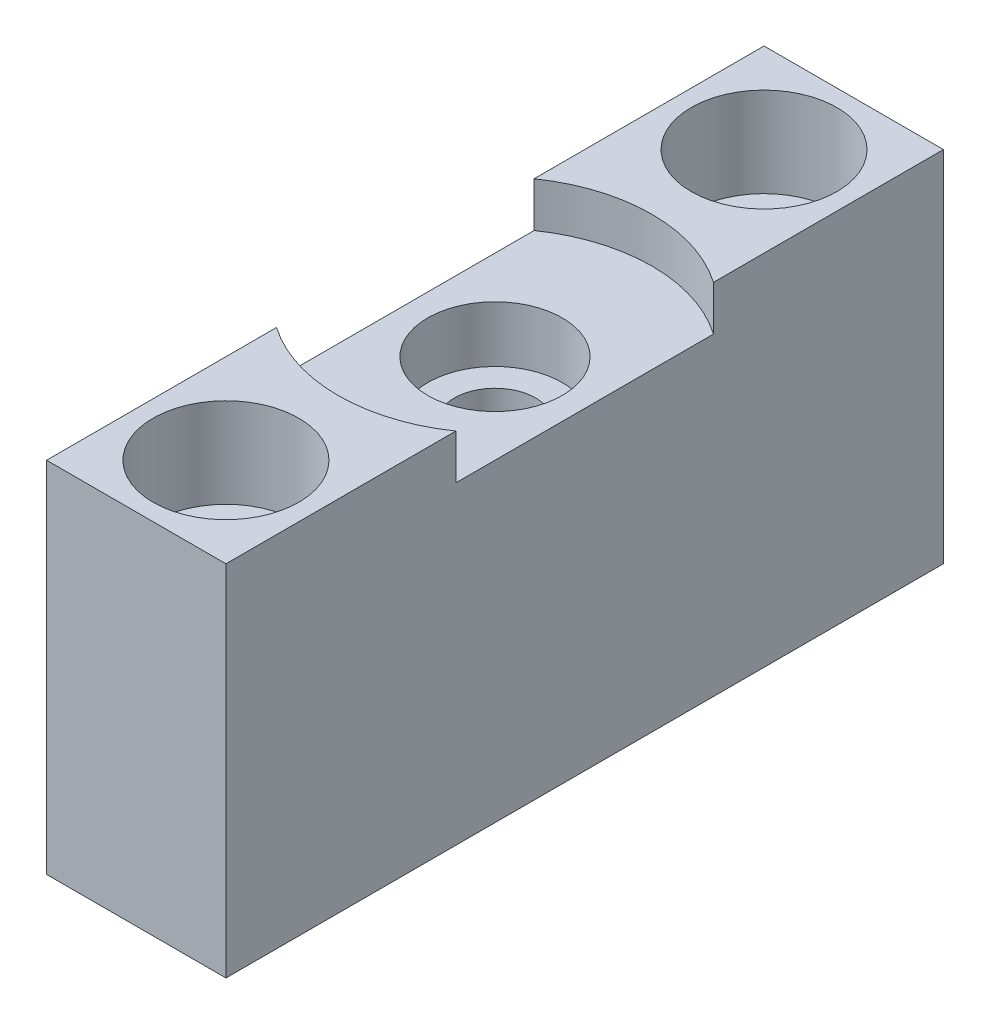
from build123d import *

# Parameters (mm, degrees)
SKETCH1_W                                        = 101.6
SKETCH1_H                                        = 50.8
BOSS_EXTRUDE1_DEPTH                              = 25.4
SKETCH2_R                                        = 22.225
CUT_EXTRUDE1_DEPTH                               = 6.35
SKETCH3_R                                        = 9.525
CUT_EXTRUDE2_DEPTH                               = 7.9375
F_1_2_20_TAPPED_HOLE1_D                          = 11.50874
CBORE_FOR_1_2_SOCKET_HEAD_CAP_SCREW1_D           = 13.49248
CBORE_FOR_1_2_SOCKET_HEAD_CAP_SCREW1_CBORE_D     = 20.6375
CBORE_FOR_1_2_SOCKET_HEAD_CAP_SCREW1_CBORE_DEPTH = 12.7


with BuildPart() as part:
    # Sketch1 → Boss-Extrude1 (new body)
    with BuildSketch(Plane(origin=(0, 0, 0), x_dir=(0, 0, -1), z_dir=(1, 0, 0))):
        with Locations((50.8, 25.4)):
            Rectangle(SKETCH1_W, SKETCH1_H)
    extrude(amount=BOSS_EXTRUDE1_DEPTH)

    # Sketch2 → Cut-Extrude1 (cut)
    with BuildSketch(Plane(origin=(0, 50.8, 0), x_dir=(1, 0, 0), z_dir=(0, 1, 0))):
        with Locations((12.7, 50.8)):
            Circle(SKETCH2_R)
    extrude(amount=-CUT_EXTRUDE1_DEPTH, mode=Mode.SUBTRACT)

    # Sketch3 → Cut-Extrude2 (cut)
    with BuildSketch(Plane(origin=(0, 44.45, 0), x_dir=(1, 0, 0), z_dir=(0, 1, 0))):
        with Locations(Location((12.7, 50.8, 0), (0, 0, 270))):
            Circle(SKETCH3_R)
    extrude(amount=-CUT_EXTRUDE2_DEPTH, mode=Mode.SUBTRACT)

    # 1/2-20 Tapped Hole1 (through all)
    with Locations(Plane(origin=(0, 36.5125, 0), x_dir=(1, 0, 0), z_dir=(0, 1, 0))):
        with Locations((12.7, 50.8)):
            Hole(F_1_2_20_TAPPED_HOLE1_D / 2)

    # CBORE for 1/2 Socket Head Cap Screw1 (through all)
    with Locations(Plane(origin=(0, 50.8, 0), x_dir=(1, 0, 0), z_dir=(0, 1, 0))):
        with Locations((12.7, 88.9), (12.7, 12.7)):
            CounterBoreHole(CBORE_FOR_1_2_SOCKET_HEAD_CAP_SCREW1_D / 2, CBORE_FOR_1_2_SOCKET_HEAD_CAP_SCREW1_CBORE_D / 2, CBORE_FOR_1_2_SOCKET_HEAD_CAP_SCREW1_CBORE_DEPTH)


solid = part.part
